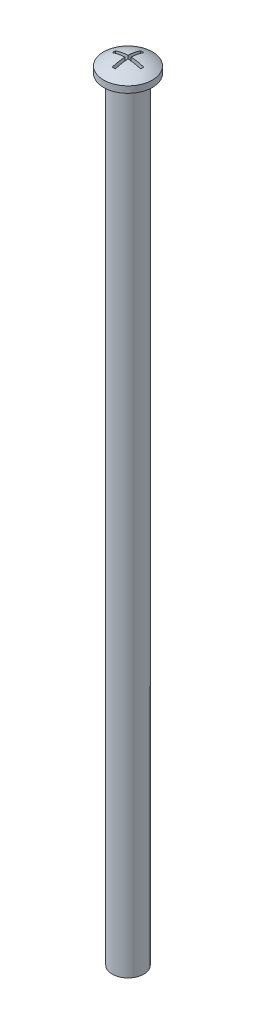
from build123d import *

# Parameters (mm, degrees)
CUT_EXTRUDE_2_DEPTH = 10


with BuildPart() as part:
    # 草图5 → 旋转1 (revolve)
    with BuildSketch(Plane.XY, mode=Mode.PRIVATE) as revolve_1_sk:
        with BuildLine():
            Line((0, -14), (-1, -14))
            Line((-1, -14), (-1, 35))
            Line((-1, 35), (-1.55, 35))
            Line((-1.55, 35), (-1.55, 35.411529967))
            add(Edge.make_bspline(
                [(-1.55, 35.411529967), (-0.860800082, 35.895988097), (0, 35.897418779)],
                knots=[0, 0, 0, 1, 1, 1], degree=2))
            Line((0, 35.897418779), (0, -14))
        make_face()
    revolve(revolve_1_sk.sketch.rotate(Axis((0, 0, 0), (0, 1, 0)), 270), axis=Axis((0, 0, 0), (0, 1, 0)))

    # 草图6 → 切除-拉伸2 (cut)
    with BuildSketch(Plane(origin=(0, 35.411529967, 0), x_dir=(-1, 0, 0), z_dir=(0, -1, 0))):
        Polygon((0.1, -0.1), (0.9, -0.1), (0.9, 0.1), (0.1, 0.1), (0.1, 0.9), (-0.1, 0.9), (-0.1, 0.1), (-0.9, 0.1), (-0.9, -0.1), (-0.1, -0.1), (-0.1, -0.9), (0.1, -0.9), align=None)
    extrude(amount=-CUT_EXTRUDE_2_DEPTH, mode=Mode.SUBTRACT)


solid = part.part
